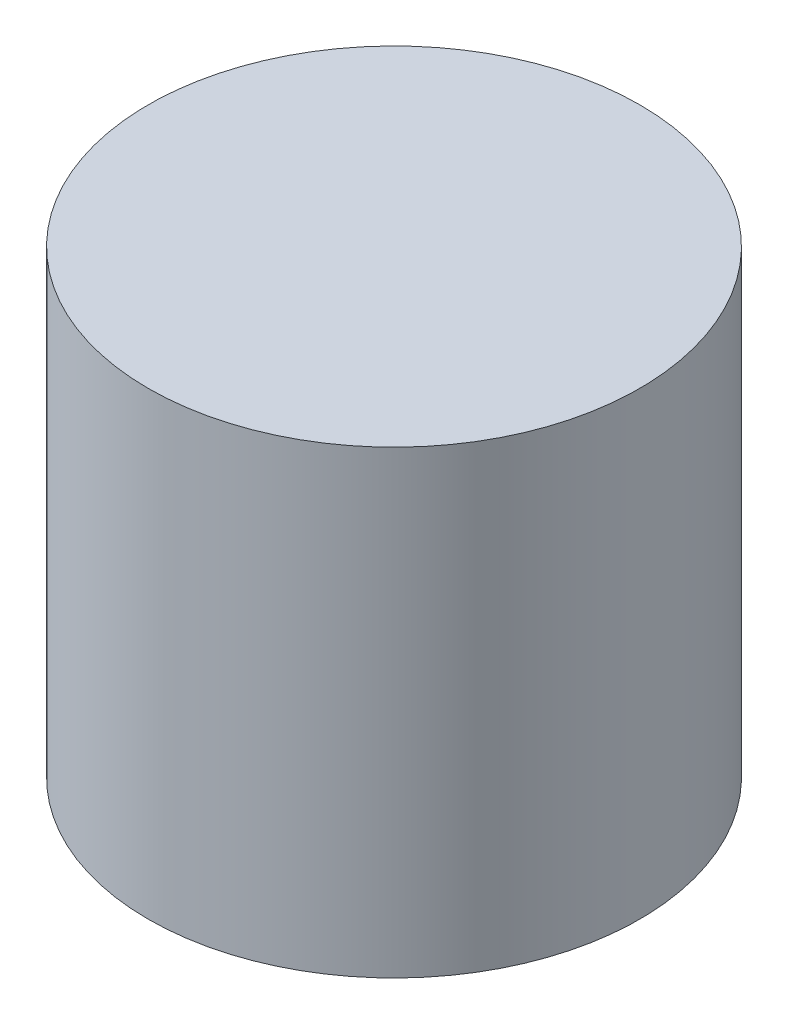
from build123d import *

# Parameters (mm, degrees)
SKETCH_1_R          = 3.1
EXTRUDE_1_DEPTH     = 5.8
SKETCH_2_R          = 1.5
CUT_EXTRUDE_1_DEPTH = 4.8


with BuildPart() as part:
    # 草图1 → 凸台-拉伸1 (new body)
    with BuildSketch(Plane(origin=(0, 0, 0), x_dir=(1, 0, 0), z_dir=(0, 1, 0))):
        with Locations(Location((0, 0, 0), (0, 0, 270))):
            Circle(SKETCH_1_R)
    extrude(amount=EXTRUDE_1_DEPTH)

    # 草图2 → 切除-拉伸1 (cut)
    with BuildSketch(Plane.XZ):
        with Locations(Location((0, 0, 0), (0, 0, 270))):
            Circle(SKETCH_2_R)
    extrude(amount=-CUT_EXTRUDE_1_DEPTH, mode=Mode.SUBTRACT)


solid = part.part
